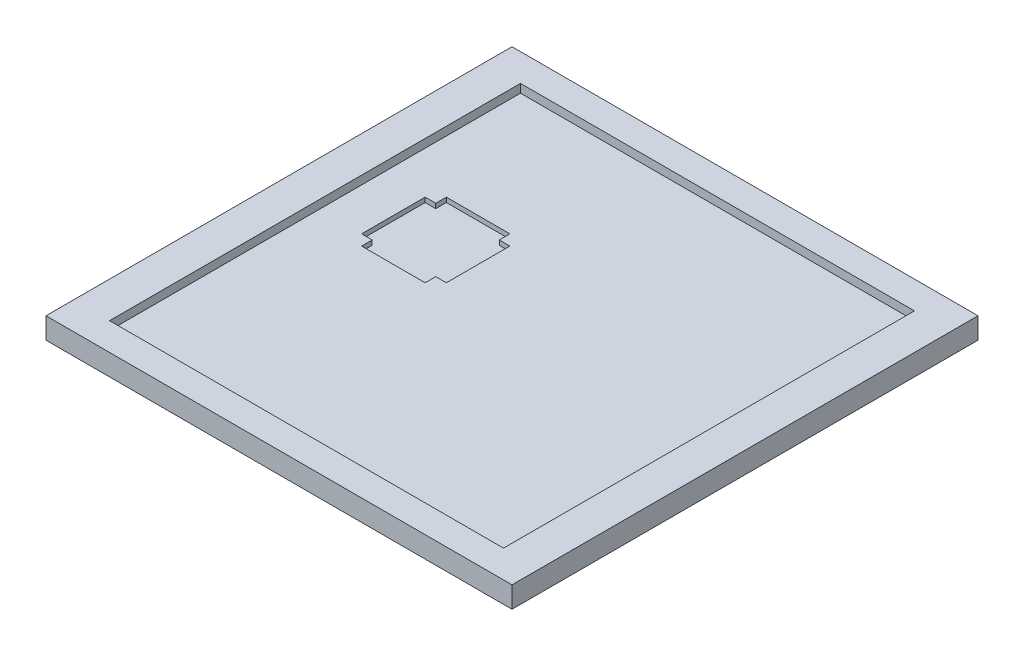
from build123d import *

# Parameters (mm, degrees)
SKETCH1_W           = 110
SKETCH1_H           = 110
BOSS_EXTRUDE1_DEPTH = 5
SKETCH2_W           = 93
SKETCH2_H           = 97
CUT_EXTRUDE1_DEPTH  = 2
CUT_EXTRUDE2_DEPTH  = 1.1


with BuildPart() as part:
    # Sketch1 → Boss-Extrude1 (new body)
    with BuildSketch(Plane(origin=(0, 0, 0), x_dir=(1, 0, 0), z_dir=(0, 1, 0))):
        with Locations((-13.863013699, -16.650684932)):
            Rectangle(SKETCH1_W, SKETCH1_H)
    extrude(amount=BOSS_EXTRUDE1_DEPTH)

    # Sketch2 → Cut-Extrude1 (cut)
    with BuildSketch(Plane(origin=(0, 5, 0), x_dir=(1, 0, 0), z_dir=(0, 1, 0))):
        with Locations((-13.863013699, -16.650684932)):
            Rectangle(SKETCH2_W, SKETCH2_H)
    extrude(amount=-CUT_EXTRUDE1_DEPTH, mode=Mode.SUBTRACT)

    # Sketch3 → Cut-Extrude2 (cut)
    with BuildSketch(Plane(origin=(0, 3, 0), x_dir=(1, 0, 0), z_dir=(0, 1, 0))):
        Polygon((-30.363013699, -0.650684932), (-32.863013699, -0.650684932), (-32.863013699, 1.849315068), (-47.863013699, 1.849315068), (-47.863013699, -0.650684932), (-50.363013699, -0.650684932), (-50.363013699, -15.650684932), (-47.863013699, -15.650684932), (-47.863013699, -18.150684932), (-32.863013699, -18.150684932), (-32.863013699, -15.650684932), (-30.363013699, -15.650684932), align=None)
    extrude(amount=-CUT_EXTRUDE2_DEPTH, mode=Mode.SUBTRACT)


solid = part.part
